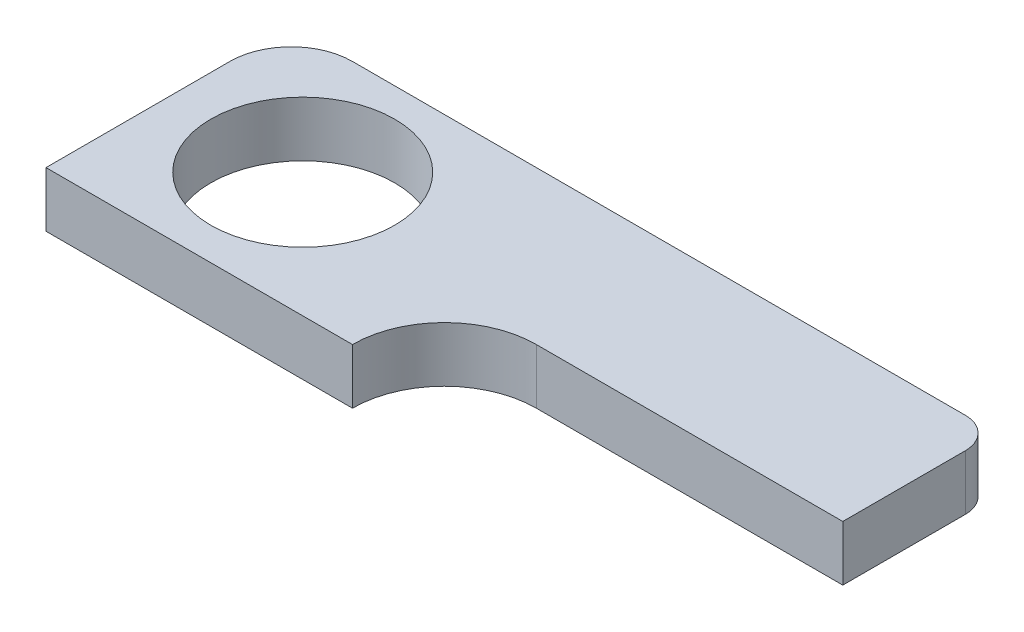
from build123d import *

# Parameters (mm, degrees)
SKETCH1_R           = 30
BOSS_EXTRUDE1_DEPTH = 18


with BuildPart() as part:
    # Sketch1 → Boss-Extrude1 (new body)
    with BuildSketch(Plane.XZ):
        with BuildLine():
            Line((230, -50), (130, -50))
            ThreePointArc((130, -50), (108.786796564, -41.213203436), (100, -20))
            Line((100, -20), (0, -20))
            Line((0, -20), (0, -80))
            ThreePointArc((0, -80), (5.857864376, -94.142135624), (20, -100))
            Line((20, -100), (220, -100))
            ThreePointArc((220, -100), (227.071067812, -97.071067812), (230, -90))
            Line((230, -90), (230, -50))
        make_face()
        with Locations(Location((43.185293748, -60.587397596, 0), (0, 0, 90))):
            Circle(SKETCH1_R, mode=Mode.SUBTRACT)
    extrude(amount=-BOSS_EXTRUDE1_DEPTH)


solid = part.part
